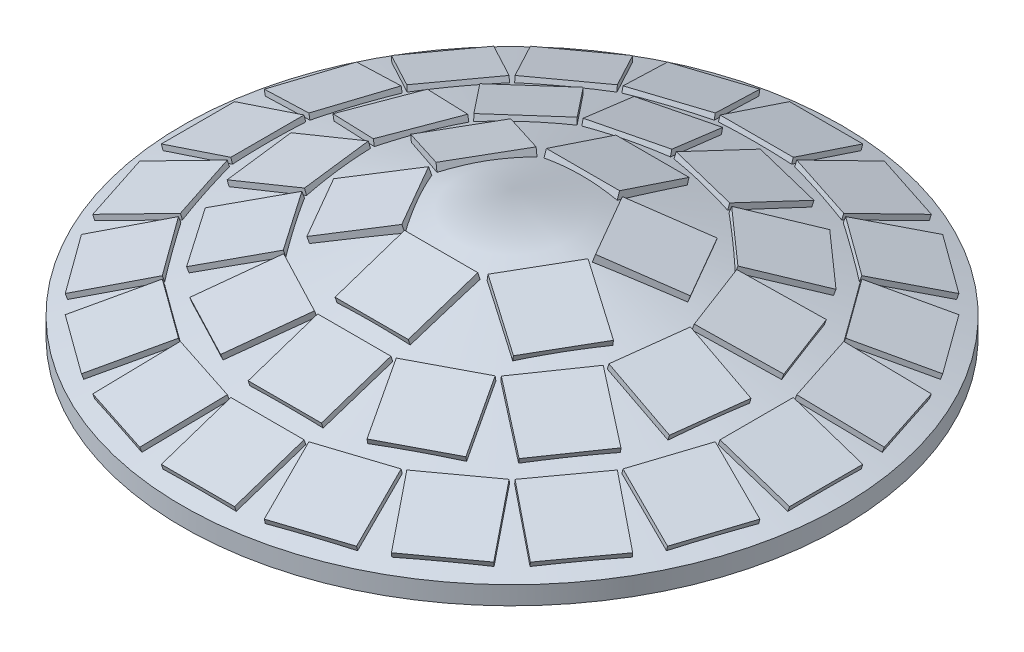
from build123d import *

# Parameters (mm, degrees)
BOSS_EXTRUDE1_DEPTH      = 50.8
BOSS_EXTRUDE1_DEPTH_BACK = 127
SKETCH2_W                = 127
SKETCH2_H                = 127
SKETCH3_W                = 102.87
SKETCH3_H                = 102.87
CUT_EXTRUDE1_DEPTH       = 127
CUT_EXTRUDE2_REACH       = 717.383
SKETCH4_R                = 3.175
CUT_EXTRUDE3_REACH       = 717.383
SKETCH5_R                = 3.175
SKETCH11_W               = 101.6
SKETCH11_H               = 101.6
BOSS_EXTRUDE5_DEPTH      = 6.35
CIRPATTERN11_COUNT       = 20
SKETCH12_W               = 101.6
SKETCH12_H               = 101.6
BOSS_EXTRUDE6_DEPTH      = 6.35
CIRPATTERN12_COUNT       = 13
SKETCH13_W               = 101.6
SKETCH13_H               = 101.6
BOSS_EXTRUDE7_DEPTH      = 6.35
CIRPATTERN13_COUNT       = 6


with BuildPart() as part:
    # Sketch1 → Revolve1 (revolve)
    with BuildSketch(Plane.XY, mode=Mode.PRIVATE) as revolve1_sk:
        Polygon((-457.2, 25.4), (0, 177.8), (0, 152.4), (-457.2, 0), align=None)
    revolve(revolve1_sk.sketch.rotate(Axis((0, 0, 0), (0, 1, 0)), 270), axis=Axis((0, 0, 0), (0, 1, 0)))

    # Sketch11 → Boss-Extrude5 (add, symmetric)
    with BuildSketch(Plane(origin=(0, 25.4, 457.2), x_dir=(1, 0, 0), z_dir=(0, 0.9486832980505138, 0.31622776601683816))):
        with Locations((0, 75.53111541)):
            Rectangle(SKETCH11_W, SKETCH11_H)
    boss_extrude5 = extrude(amount=BOSS_EXTRUDE5_DEPTH, both=True)

    # CirPattern11: Boss-Extrude5 ×20 about axis
    cirpattern11_axis = Axis((0, 0, 0), (0, 1, 0))
    for i in range(1, CIRPATTERN11_COUNT):
        add(boss_extrude5.rotate(cirpattern11_axis, i * 360 / CIRPATTERN11_COUNT))

    # Sketch12 → Boss-Extrude6 (add, symmetric)
    with BuildSketch(Plane(origin=(0, 25.4, 457.2), x_dir=(1, 0, 0), z_dir=(0, 0.9486832980505138, 0.31622776601683816))):
        with Locations((0, 202.53111541)):
            Rectangle(SKETCH12_W, SKETCH12_H)
    boss_extrude6 = extrude(amount=BOSS_EXTRUDE6_DEPTH, both=True)

    # CirPattern12: Boss-Extrude6 ×13 about axis
    cirpattern12_axis = Axis((0, 0, 0), (0, 1, 0))
    for i in range(1, CIRPATTERN12_COUNT):
        add(boss_extrude6.rotate(cirpattern12_axis, i * 360 / CIRPATTERN12_COUNT))

    # Sketch13 → Boss-Extrude7 (add, symmetric)
    with BuildSketch(Plane(origin=(0, 25.4, 457.2), x_dir=(1, 0, 0), z_dir=(0, 0.9486832980505138, 0.31622776601683816))):
        with Locations((0, 329.53111541)):
            Rectangle(SKETCH13_W, SKETCH13_H)
    boss_extrude7 = extrude(amount=BOSS_EXTRUDE7_DEPTH, both=True)

    # CirPattern13: Boss-Extrude7 ×6 about axis
    cirpattern13_axis = Axis((0, 0, 0), (0, 1, 0))
    for i in range(1, CIRPATTERN13_COUNT):
        add(boss_extrude7.rotate(cirpattern13_axis, i * 360 / CIRPATTERN13_COUNT))


with BuildPart() as body_2:
    # Sketch2 → Boss-Extrude1 (new, two sides: drawn at the far end of the back side and taken through both)
    with BuildSketch(Plane(origin=(0, 0, 0), x_dir=(1, 0, 0), z_dir=(0, 1, 0)).offset(-BOSS_EXTRUDE1_DEPTH_BACK)):
        Rectangle(SKETCH2_W, SKETCH2_H)
    extrude(amount=BOSS_EXTRUDE1_DEPTH + BOSS_EXTRUDE1_DEPTH_BACK)

    # Sketch3 → Cut-Extrude1 (cut)
    with BuildSketch(Plane.XZ.offset(127)):
        Rectangle(SKETCH3_W, SKETCH3_H)
    extrude(amount=-CUT_EXTRUDE1_DEPTH, mode=Mode.SUBTRACT)

    # Cut-Extrude2: up to this face of the body (flat: up to its plane)
    cut_extrude2_end = Plane(body_2.part.faces().sort_by_distance((-63.5, -38.1, 0))[0])
    # Sketch4 → Cut-Extrude2 (cut, up to the picked face)
    with BuildSketch(Plane(origin=(63.5, 0, 0), x_dir=(0, 0, -1), z_dir=(1, 0, 0)), mode=Mode.PRIVATE) as cut_extrude2_sk1:
        with Locations((-31.75, -63.5)):
            Circle(SKETCH4_R)
    cut_extrude2_tool1 = split(extrude(cut_extrude2_sk1.sketch, amount=-CUT_EXTRUDE2_REACH, mode=Mode.PRIVATE), bisect_by=cut_extrude2_end, keep=Keep.BOTH, mode=Mode.PRIVATE)
    # Sketch4 → Cut-Extrude2 (cut, up to the picked face)
    with BuildSketch(Plane(origin=(63.5, 0, 0), x_dir=(0, 0, -1), z_dir=(1, 0, 0)), mode=Mode.PRIVATE) as cut_extrude2_sk2:
        with Locations((31.75, -63.5)):
            Circle(SKETCH4_R)
    cut_extrude2_tool2 = split(extrude(cut_extrude2_sk2.sketch, amount=-CUT_EXTRUDE2_REACH, mode=Mode.PRIVATE), bisect_by=cut_extrude2_end, keep=Keep.BOTH, mode=Mode.PRIVATE)
    add(cut_extrude2_tool1.solids().sort_by(Axis((63.5, -63.5, 31.75), (-1, 0, 0)))[0], mode=Mode.SUBTRACT)
    add(cut_extrude2_tool2.solids().sort_by(Axis((63.5, -63.5, -31.75), (-1, 0, 0)))[0], mode=Mode.SUBTRACT)

    # Cut-Extrude3: up to this face of the body (flat: up to its plane)
    cut_extrude3_end = Plane(body_2.part.faces().sort_by_distance((0, -38.1, -63.5))[0])
    # Sketch5 → Cut-Extrude3 (cut, up to the picked face)
    with BuildSketch(Plane.XY.offset(63.5), mode=Mode.PRIVATE) as cut_extrude3_sk1:
        with Locations(Location((-31.75, -50.8, 0), (0, 0, 180))):
            Circle(SKETCH5_R)
    cut_extrude3_tool1 = split(extrude(cut_extrude3_sk1.sketch, amount=-CUT_EXTRUDE3_REACH, mode=Mode.PRIVATE), bisect_by=cut_extrude3_end, keep=Keep.BOTH, mode=Mode.PRIVATE)
    # Sketch5 → Cut-Extrude3 (cut, up to the picked face)
    with BuildSketch(Plane.XY.offset(63.5), mode=Mode.PRIVATE) as cut_extrude3_sk2:
        with Locations(Location((31.75, -50.8, 0), (0, 0, 180))):
            Circle(SKETCH5_R)
    cut_extrude3_tool2 = split(extrude(cut_extrude3_sk2.sketch, amount=-CUT_EXTRUDE3_REACH, mode=Mode.PRIVATE), bisect_by=cut_extrude3_end, keep=Keep.BOTH, mode=Mode.PRIVATE)
    add(cut_extrude3_tool1.solids().sort_by(Axis((-31.75, -50.8, 63.5), (0, 0, -1)))[0], mode=Mode.SUBTRACT)
    add(cut_extrude3_tool2.solids().sort_by(Axis((31.75, -50.8, 63.5), (0, 0, -1)))[0], mode=Mode.SUBTRACT)


solid = Compound([part.part, body_2.part])
